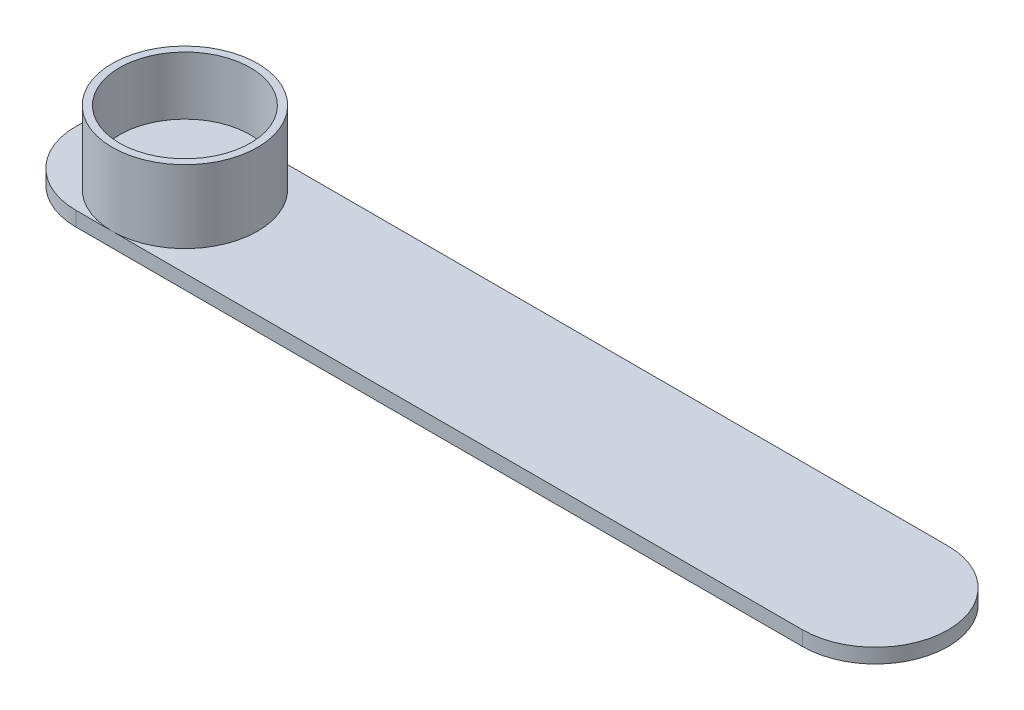
from build123d import *

# Parameters (mm, degrees)
BOSS_EXTRUDE1_DEPTH = 2
SKETCH2_R           = 10
BOSS_EXTRUDE2_DEPTH = 10
SKETCH3_R           = 9
CUT_EXTRUDE1_DEPTH  = 8


with BuildPart() as part:
    # Sketch1 → Boss-Extrude1 (new body)
    with BuildSketch(Plane(origin=(0, 0, 0), x_dir=(1, 0, 0), z_dir=(0, 1, 0))):
        with BuildLine():
            Line((-30, -10), (70, -10))
            ThreePointArc((70, -10), (80, 0), (70, 10))
            Line((70, 10), (-30, 10))
            ThreePointArc((-30, 10), (-40, 0), (-30, -10))
        make_face()
    extrude(amount=BOSS_EXTRUDE1_DEPTH)

    # Sketch2 → Boss-Extrude2 (add)
    with BuildSketch(Plane(origin=(0, 2, 0), x_dir=(1, 0, 0), z_dir=(0, 1, 0))):
        with Locations(Location((-25, 0, 0), (0, 0, 270))):
            Circle(SKETCH2_R)
    extrude(amount=BOSS_EXTRUDE2_DEPTH)

    # Sketch3 → Cut-Extrude1 (cut)
    with BuildSketch(Plane(origin=(0, 12, 0), x_dir=(1, 0, 0), z_dir=(0, 1, 0))):
        with Locations(Location((-25, 0, 0), (0, 0, 270))):
            Circle(SKETCH3_R)
    extrude(amount=-CUT_EXTRUDE1_DEPTH, mode=Mode.SUBTRACT)


solid = part.part
